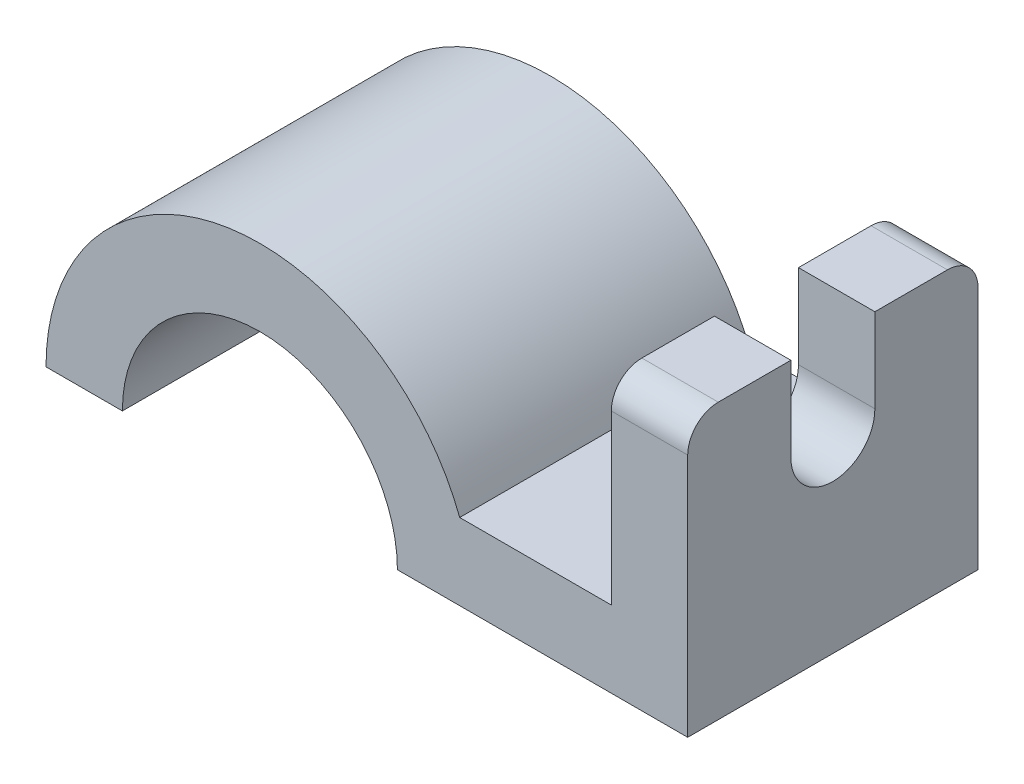
from build123d import *

# Parameters (mm, degrees)
EXTRUDE_1_DEPTH = 10
FILLET_1_R      = 4
EXTRUDE_2_DEPTH = 38


with BuildPart() as part:
    # 草圖1 → 填料-伸長1 (new body)
    with BuildSketch(Plane(origin=(0, 0, 0), x_dir=(0, 0, -1), z_dir=(1, 0, 0))):
        with BuildLine():
            Line((0, 0), (38, 0))
            Line((38, 0), (38, 36))
            Line((38, 36), (24.5, 36))
            Line((24.5, 36), (24.5, 25))
            ThreePointArc((24.5, 25), (19, 19.5), (13.5, 25))
            Line((13.5, 25), (13.5, 36))
            Line((13.5, 36), (0, 36))
            Line((0, 36), (0, 0))
        make_face()
    extrude(amount=EXTRUDE_1_DEPTH)

    # 圓角1
    fillet_1_edges = [part.edges().sort_by_distance(p)[0] for p in [
        (5, 36, 0),
        (5, 36, -38),
    ]]
    fillet(fillet_1_edges, radius=FILLET_1_R)

    # 草圖2 → 填料-伸長2 (add)
    with BuildSketch(Plane.XY):
        with BuildLine():
            Line((-64, 0), (-74, 0))
            ThreePointArc((-74, 0), (-51.08453427, 27.534478591), (-19.846606339, 10))
            Line((-19.846606339, 10), (0, 10))
            Line((0, 10), (0, 0))
            Line((0, 0), (-28, 0))
            ThreePointArc((-28, 0), (-46, 18), (-64, 0))
        make_face()
    extrude(amount=-EXTRUDE_2_DEPTH)


solid = part.part
